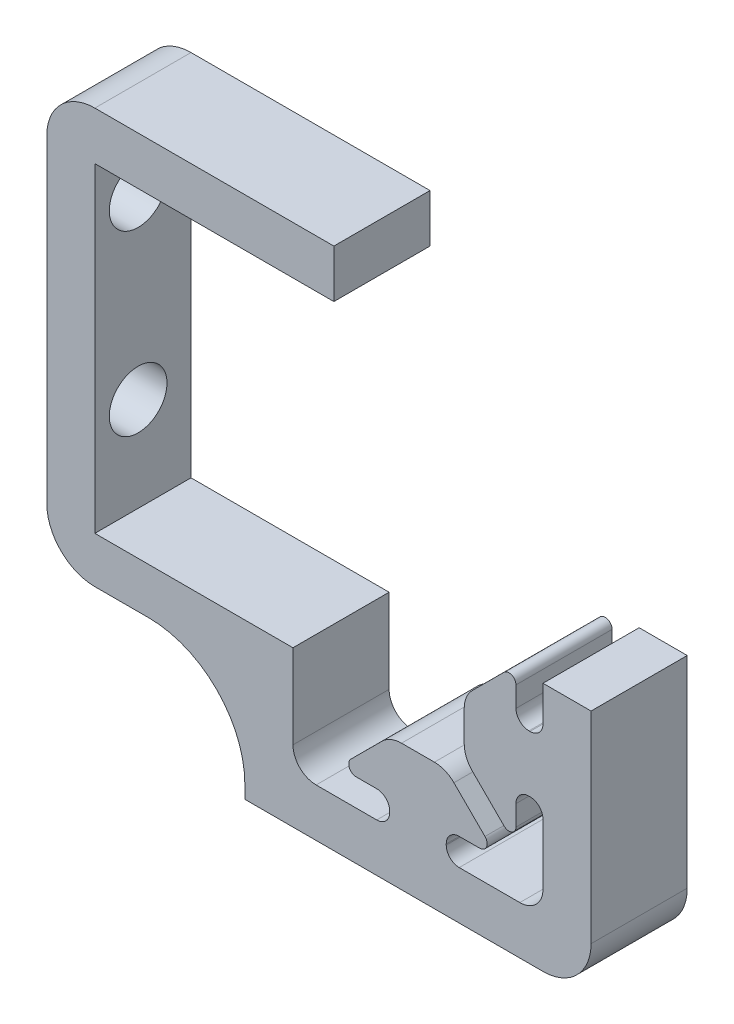
from build123d import *

# Parameters (mm, degrees)
BOSS_EXTRUDE1_DEPTH = 10
CUT_EXTRUDE1_REACH  = 70.061
SKETCH2_R           = 3
FILLET1_R           = 10
FILLET2_R           = 5
CUT_EXTRUDE2_DEPTH  = 125


with BuildPart() as part:
    # Sketch1 → Boss-Extrude1 (new body)
    with BuildSketch(Plane.XY):
        with BuildLine():
            Line((-10.5918, -13), (-4.305880552, -13))
            Line((-4.305880552, -13), (-4.287512407, -13))
            ThreePointArc((-4.287512407, -13), (-3.333616586, -12.604883414), (-2.9385, -11.650987593))
            Line((-2.9385, -11.650987593), (-2.9385, -11.539212407))
            ThreePointArc((-2.9385, -11.539212407), (-3.333616586, -10.585316586), (-4.287512407, -10.1902))
            Line((-4.287512407, -10.1902), (-6.416408329, -10.1902))
            ThreePointArc((-6.416408329, -10.1902), (-7.137514675, -9.708134418), (-6.967711912, -8.857517813))
            Line((-6.967711912, -8.857517813), (-3.740331666, -5.636015806))
            ThreePointArc((-3.740331666, -5.636015806), (-2.808257752, -5.01414519), (-1.709253557, -4.7958))
            Line((-1.709253557, -4.7958), (1.709253557, -4.7958))
            ThreePointArc((1.709253557, -4.7958), (2.808257752, -5.01414519), (3.740331666, -5.636015806))
            Line((3.740331666, -5.636015806), (6.967711912, -8.857517813))
            ThreePointArc((6.967711912, -8.857517813), (7.137514675, -9.708134418), (6.416408329, -10.1902))
            Line((6.416408329, -10.1902), (4.287512407, -10.1902))
            ThreePointArc((4.287512407, -10.1902), (3.333616586, -10.585316586), (2.9385, -11.539212407))
            Line((2.9385, -11.539212407), (2.9385, -11.650987593))
            ThreePointArc((2.9385, -11.650987593), (3.333616586, -12.604883414), (4.287512407, -13))
            Line((4.287512407, -13), (5.321597603, -13))
            Line((5.321597603, -13), (10.5918, -13))
            ThreePointArc((10.5918, -13), (12.29465455, -12.29465455), (13, -10.5918))
            Line((13, -10.5918), (13, -5.3170836))
            Line((13, -5.3170836), (13, -4.287469289))
            ThreePointArc((13, -4.287469289), (12.604883414, -3.333573468), (11.650987593, -2.938456882))
            Line((11.650987593, -2.938456882), (11.539212407, -2.938456882))
            ThreePointArc((11.539212407, -2.938456882), (10.585316586, -3.333573468), (10.1902, -4.287469289))
            Line((10.1902, -4.287469289), (10.1902, -6.402089023))
            ThreePointArc((10.1902, -6.402089023), (9.74154152, -7.073969797), (8.94902056, -6.917034355))
            Line((8.94902056, -6.917034355), (5.652895046, -3.628441884))
            ThreePointArc((5.652895046, -3.628441884), (5.027976112, -2.694919539), (4.8085, -1.593185507))
            Line((4.8085, -1.593185507), (4.8085, 1.593185507))
            ThreePointArc((4.8085, 1.593185507), (5.027976112, 2.694919539), (5.652895046, 3.628441884))
            Line((5.652895046, 3.628441884), (8.94902056, 6.917034355))
            ThreePointArc((8.94902056, 6.917034355), (9.74154152, 7.073969797), (10.1902, 6.402089023))
            Line((10.1902, 6.402089023), (10.1902, 4.287469289))
            ThreePointArc((10.1902, 4.287469289), (10.585316586, 3.333573468), (11.539212407, 2.938456882))
            Line((11.539212407, 2.938456882), (11.650987593, 2.938456882))
            ThreePointArc((11.650987593, 2.938456882), (12.604883414, 3.333573468), (13, 4.287469289))
            Line((13, 4.287469289), (13, 5.3170836))
            Line((13, 5.3170836), (13, 7.9544418))
            Line((13, 7.9544418), (18, 7.9544418))
            Line((18, 7.9544418), (18, -18))
            Line((18, -18), (-18, -18))
            Line((-18, -18), (-18, -6.6473334))
            Line((-18, -6.6473334), (-38.6, -6.6473334))
            Line((-38.6, -6.6473334), (-38.6, 36.4526666))
            Line((-38.6, 36.4526666), (-8.745302284, 36.4526666))
            Line((-8.745302284, 36.4526666), (-8.745302284, 31.4526666))
            Line((-8.745302284, 31.4526666), (-33.6, 31.4526666))
            Line((-33.6, 31.4526666), (-33.6, -1.8473334))
            Line((-33.6, -1.8473334), (-13, -1.8473334))
            Line((-13, -1.8473334), (-13, -4.287469289))
            Line((-13, -4.287469289), (-13, -10.5918))
            ThreePointArc((-13, -10.5918), (-12.29465455, -12.29465455), (-10.5918, -13))
        make_face()
    extrude(amount=BOSS_EXTRUDE1_DEPTH)

    # Sketch2 → Cut-Extrude1 (cut, up to next)
    with BuildSketch(Plane.ZY.offset(38.6), mode=Mode.PRIVATE) as cut_extrude1_sk1:
        with Locations((4.5, 26.4526666)):
            Circle(SKETCH2_R)
    cut_extrude1_tool1 = extrude(cut_extrude1_sk1.sketch, amount=-CUT_EXTRUDE1_REACH, mode=Mode.PRIVATE) & part.part
    # Sketch2 → Cut-Extrude1 (cut, up to next)
    with BuildSketch(Plane.ZY.offset(38.6), mode=Mode.PRIVATE) as cut_extrude1_sk2:
        with Locations((4.5, 7.9526666)):
            Circle(SKETCH2_R)
    cut_extrude1_tool2 = extrude(cut_extrude1_sk2.sketch, amount=-CUT_EXTRUDE1_REACH, mode=Mode.PRIVATE) & part.part
    add(cut_extrude1_tool1.solids().sort_by_distance((-38.6, 26.452667, 4.5))[0], mode=Mode.SUBTRACT)
    add(cut_extrude1_tool2.solids().sort_by_distance((-38.6, 7.952667, 4.5))[0], mode=Mode.SUBTRACT)

    # Fillet1
    fillet1_edges = [part.edges().sort_by_distance(p)[0] for p in [
        (-18, -6.6473334, 5),
    ]]
    fillet(fillet1_edges, radius=FILLET1_R)

    # Fillet2
    fillet2_edges = [part.edges().sort_by_distance(p)[0] for p in [
        (18, -18, 5),
        (-38.6, -6.6473334, 5),
        (-38.6, 36.4526666, 5),
    ]]
    fillet(fillet2_edges, radius=FILLET2_R)


with BuildPart() as body_2:
    # Mirror1: mirrored copy
    add(part.part.mirror(Plane.XY))


with BuildPart() as part_1:
    add(part.part)

    # Sketch3 → Cut-Extrude2 (cut)
    with BuildSketch(Plane.ZY.offset(38.6)):
        Polygon((0, 36.4526666), (0, 49.999859465), (29.852045942, 49.999859465), (29.852045942, -34.667615785), (0, -34.667615785), align=None)
    extrude(amount=-CUT_EXTRUDE2_DEPTH, mode=Mode.SUBTRACT)


solid = body_2.part
